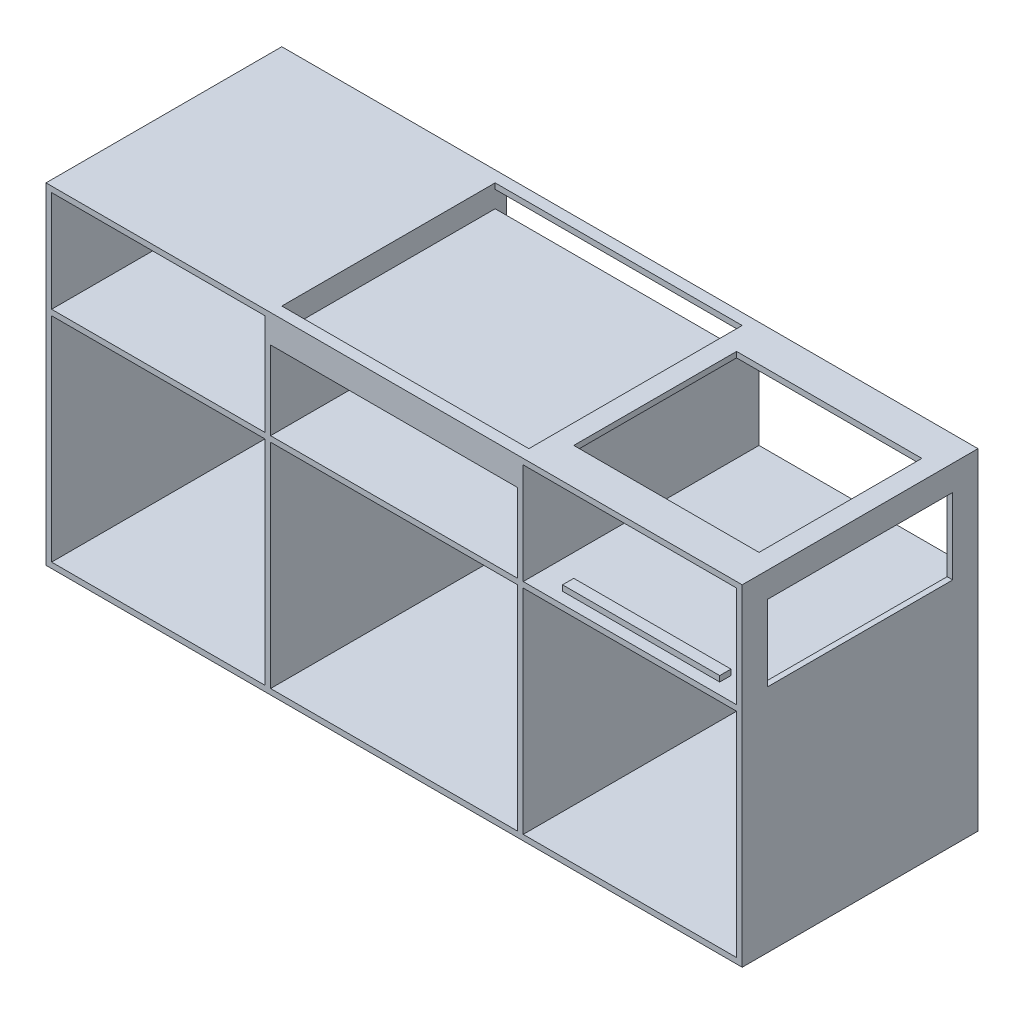
from build123d import *

# Parameters (mm, degrees)
BASE_W                   = 440
BASE_H                   = 420
PLANCHE_BAS_DEPTH        = 10
BASE_W_2                 = 380
PLANCHE_BAS_2_DEPTH      = 10
PLANCHE_BAS_3_DEPTH      = 10
BASE_6_W                 = 10
BASE_6_H                 = 420
PANNEAUX_LATERAUX_DEPTH  = 580
BASE_7_W                 = 10
BASE_7_H                 = 420
PANNEAUX_BAS_INTER_DEPTH = 390
ESQUISSE2_W              = 380
ESQUISSE2_H              = 420
BOSS_EXTRU_9_DEPTH       = 10
ESQUISSE2_W_2            = 440
BOSS_EXTRU_9_2_DEPTH     = 10
ESQUISSE2_W_3            = 280
ESQUISSE2_H_2            = 20
BOSS_EXTRU_9_3_DEPTH     = 10
ESQUISSE2_4_W            = 10
ESQUISSE2_4_H            = 420
BOSS_EXTRU_10_DEPTH      = 190
ESQUISSE5_W              = 1240
ESQUISSE5_H              = 420
ESQUISSE5_W_2            = 330
ESQUISSE5_H_2            = 290
ESQUISSE5_W_3            = 440
ESQUISSE5_H_3            = 380
BOSS_EXTRU_11_DEPTH      = 10
ESQUISSE7_W              = 440
ESQUISSE7_H              = 380
BOSS_EXTRU_12_DEPTH      = 10
BOSS_EXTRU_13_DEPTH      = 30
BOSS_EXTRU_13_DEPTH_BACK = 10
ESQUISSE7_3_W            = 440
ESQUISSE7_3_H            = 20
ESQUISSE8_W              = 330
ESQUISSE8_H              = 135
ENL_V_MAT_EXTRU_3_DEPTH  = 10
ESQUISSE2_5_W            = 280
ESQUISSE2_5_H            = 20
BOSS_EXTRU_14_DEPTH      = 20


with BuildPart() as part:
    # base → planche_bas (new body)
    with BuildSketch(Plane(origin=(0, 0, 0), x_dir=(1, 0, 0), z_dir=(0, 1, 0))):
        with Locations((-3.173777315, -21.477627471)):
            Rectangle(BASE_W, BASE_H)
    extrude(amount=PLANCHE_BAS_DEPTH)



with BuildPart() as body_2:
    # base → planche_bas 2 (new body)
    with BuildSketch(Plane(origin=(0, 0, 0), x_dir=(1, 0, 0), z_dir=(0, 1, 0))):
        with Locations((-423.173777315, -21.477627471)):
            Rectangle(BASE_W_2, BASE_H)
    extrude(amount=PLANCHE_BAS_2_DEPTH)



with BuildPart() as body_3:
    # base → planche_bas 3 (new body)
    with BuildSketch(Plane(origin=(0, 0, 0), x_dir=(1, 0, 0), z_dir=(0, 1, 0))):
        with Locations((416.826222685, -21.477627471)):
            Rectangle(BASE_W_2, BASE_H)
    extrude(amount=PLANCHE_BAS_3_DEPTH)


with BuildPart() as body_2_1:
    add(body_2.part)

    add(body_3.part)  # panneaux_lateraux merges body 3
    # base<6> → panneaux_lateraux (add)
    with BuildSketch(Plane(origin=(0, 0, 0), x_dir=(1, 0, 0), z_dir=(0, 1, 0))):
        with Locations((-618.173777315, -21.477627471)):
            Rectangle(BASE_6_W, BASE_6_H)
        with Locations((611.826222685, -21.477627471)):
            Rectangle(BASE_6_W, BASE_6_H)
    extrude(amount=PANNEAUX_LATERAUX_DEPTH)


with BuildPart() as part_1:
    add(part.part)

    add(body_2_1.part)  # panneaux_bas_inter merges body 2
    # base<7> → panneaux_bas_inter (add)
    with BuildSketch(Plane(origin=(0, 0, 0), x_dir=(1, 0, 0), z_dir=(0, 1, 0))):
        with Locations((-228.173777315, -21.477627471)):
            Rectangle(BASE_7_W, BASE_7_H)
        with Locations((221.826222685, -21.477627471)):
            Rectangle(BASE_7_W, BASE_7_H)
    extrude(amount=PANNEAUX_BAS_INTER_DEPTH)



with BuildPart() as body_2_2:
    # Esquisse2 → Boss.-Extru.9 (new body)
    with BuildSketch(Plane(origin=(0, 390, 0), x_dir=(1, 0, 0), z_dir=(0, 1, 0))):
        with Locations((-423.173777315, -21.477627471)):
            Rectangle(ESQUISSE2_W, ESQUISSE2_H)
    extrude(amount=BOSS_EXTRU_9_DEPTH)


with BuildPart() as body_3_2:
    # Esquisse2 → Boss.-Extru.9 2 (new body)
    with BuildSketch(Plane(origin=(0, 390, 0), x_dir=(1, 0, 0), z_dir=(0, 1, 0))):
        with Locations((-3.173777315, -21.477627471)):
            Rectangle(ESQUISSE2_W_2, ESQUISSE2_H)
    extrude(amount=BOSS_EXTRU_9_2_DEPTH)


with BuildPart() as body_4:
    # Esquisse2 → Boss.-Extru.9 3 (new body)
    with BuildSketch(Plane(origin=(0, 390, 0), x_dir=(1, 0, 0), z_dir=(0, 1, 0))):
        with Locations((416.826222685, -21.477627471)):
            Rectangle(ESQUISSE2_W, ESQUISSE2_H)
        with Locations((416.826222685, -201.477627471)):
            Rectangle(ESQUISSE2_W_3, ESQUISSE2_H_2, mode=Mode.SUBTRACT)
    extrude(amount=BOSS_EXTRU_9_3_DEPTH)


with BuildPart() as part_2:
    add(part_1.part)

    add(body_2_2.part)  # Boss.-Extru.10 merges body 2 2

    add(body_3_2.part)  # Boss.-Extru.10 merges body 3 2

    add(body_4.part)  # Boss.-Extru.10 merges body 4
    # Esquisse2<4> → Boss.-Extru.10 (add)
    with BuildSketch(Plane(origin=(0, 390, 0), x_dir=(1, 0, 0), z_dir=(0, 1, 0))):
        with Locations((-228.173777315, -21.477627471)):
            Rectangle(ESQUISSE2_4_W, ESQUISSE2_4_H)
        with Locations((221.826222685, -21.477627471)):
            Rectangle(ESQUISSE2_4_W, ESQUISSE2_4_H)
    extrude(amount=BOSS_EXTRU_10_DEPTH)

    # Esquisse5 → Boss.-Extru.11 (add)
    with BuildSketch(Plane(origin=(0, 580, 0), x_dir=(1, 0, 0), z_dir=(0, 1, 0))):
        with Locations((-3.173777315, -21.477627471)):
            Rectangle(ESQUISSE5_W, ESQUISSE5_H)
        with Locations((416.826222685, -21.477627471)):
            Rectangle(ESQUISSE5_W_2, ESQUISSE5_H_2, mode=Mode.SUBTRACT)
        with Locations((-3.173777315, -21.477627471)):
            Rectangle(ESQUISSE5_W_3, ESQUISSE5_H_3, mode=Mode.SUBTRACT)
    extrude(amount=BOSS_EXTRU_11_DEPTH)

    # Esquisse7 → Boss.-Extru.12 (add)
    with BuildSketch(Plane(origin=(0, 550, 0), x_dir=(1, 0, 0), z_dir=(0, 1, 0))):
        with Locations((-3.173777315, -21.477627471)):
            Rectangle(ESQUISSE7_W, ESQUISSE7_H)
    extrude(amount=-BOSS_EXTRU_12_DEPTH)

    # Esquisse7<3> → Boss.-Extru.13 (add, two sides: drawn at the far end of the back side and taken through both)
    with BuildSketch(Plane(origin=(0, 550, 0), x_dir=(1, 0, 0), z_dir=(0, 1, 0)).offset(-BOSS_EXTRU_13_DEPTH_BACK)):
        with Locations((-3.173777315, -221.477627471)):
            Rectangle(ESQUISSE7_3_W, ESQUISSE7_3_H)
    extrude(amount=BOSS_EXTRU_13_DEPTH + BOSS_EXTRU_13_DEPTH_BACK)

    # Esquisse8 → Enlèv. mat.-Extru.3 (cut)
    with BuildSketch(Plane(origin=(616.826222685, 0, 0), x_dir=(0, 0, -1), z_dir=(1, 0, 0))):
        with Locations((-21.477627471, 477.5)):
            Rectangle(ESQUISSE8_W, ESQUISSE8_H)
    extrude(amount=-ENL_V_MAT_EXTRU_3_DEPTH, mode=Mode.SUBTRACT)

    # Esquisse2<5> → Boss.-Extru.14 (add)
    with BuildSketch(Plane(origin=(0, 390, 0), x_dir=(1, 0, 0), z_dir=(0, 1, 0))):
        with Locations((416.826222685, -201.477627471)):
            Rectangle(ESQUISSE2_5_W, ESQUISSE2_5_H)
    extrude(amount=BOSS_EXTRU_14_DEPTH)


solid = part_2.part
